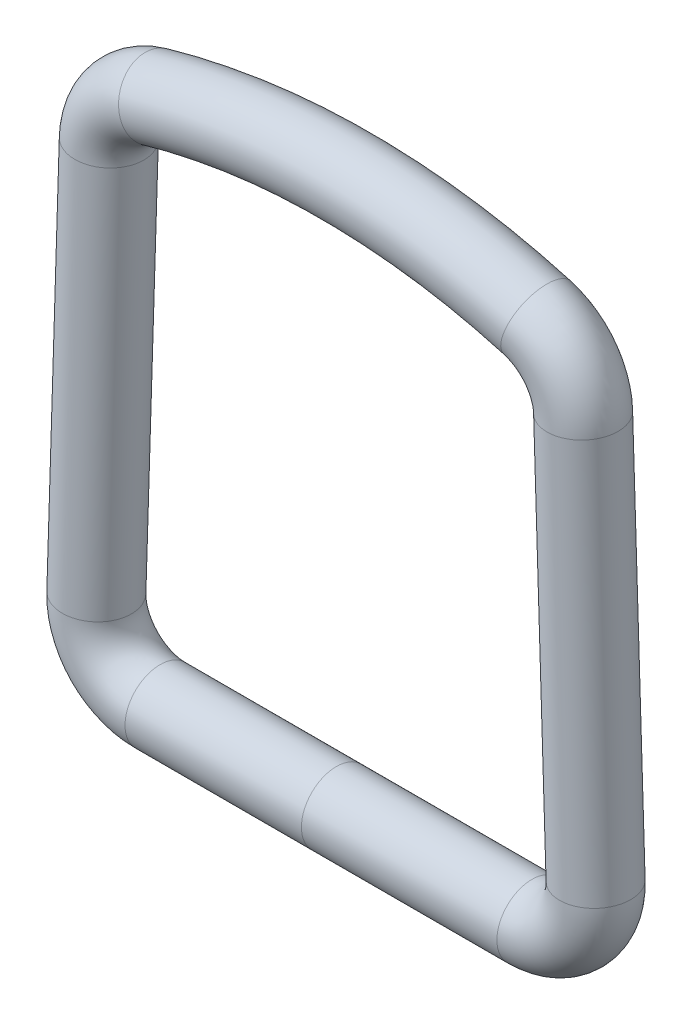
from build123d import *

# Parameters (mm, degrees)
SKETCH_3_R = 1.1


with BuildPart() as part:
    # 扫描1: sweep along a path in 草图1
    with BuildLine(Plane.XY) as sweep_1_path:
        Line((2.063476324, 0), (13.736523676, 0))
        ThreePointArc((13.736523676, 0), (15.17265372, 0.608047955), (15.735547828, 2.062469505))
        Line((15.735547828, 2.062469505), (15.343889389, 14.595539539))
        ThreePointArc((15.343889389, 14.595539539), (14.923518493, 15.761017061), (13.897319856, 16.455254701))
        ThreePointArc((13.897319856, 16.455254701), (7.9, 17.3), (1.902680144, 16.455254701))
        ThreePointArc((1.902680144, 16.455254701), (0.876481507, 15.761017061), (0.456110611, 14.595539539))
        Line((0.456110611, 14.595539539), (0.064452172, 2.062469505))
        ThreePointArc((0.064452172, 2.062469505), (0.62734628, 0.608047955), (2.063476324, 0))
    # 草图3 → 扫描1 (sweep)
    with BuildSketch(Plane(origin=(7.6, 0, 0), x_dir=(0, 0, -1), z_dir=(1, 0, 0))):
        Circle(SKETCH_3_R)
    sweep(path=sweep_1_path.line)


solid = part.part
